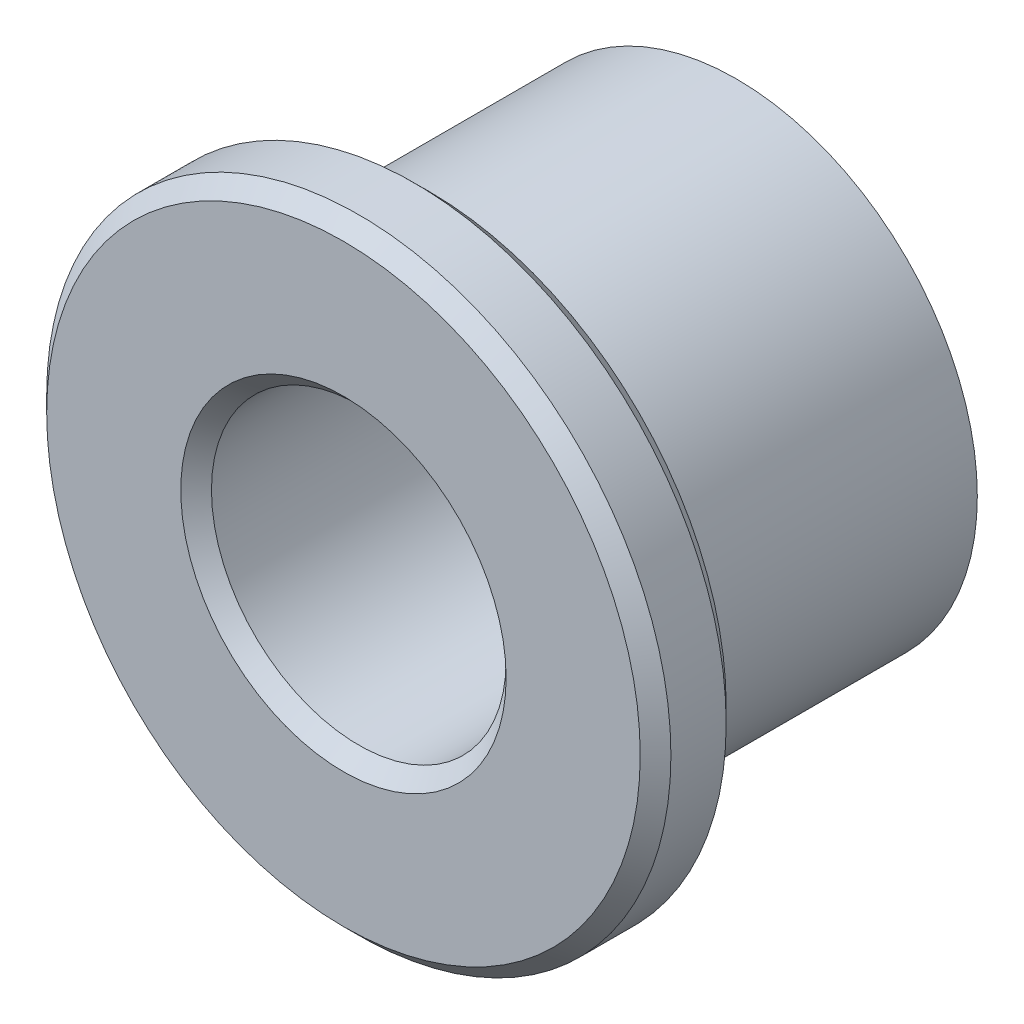
from build123d import *

# Parameters (mm, degrees)
SKETCH1_R           = 3.925
BOSS_EXTRUDE1_DEPTH = 11
SKETCH2_R           = 5.084149635
BOSS_EXTRUDE2_DEPTH = 1.4
SKETCH3_R           = 2.4
CUT_EXTRUDE1_DEPTH  = 15.333776719
CHAMFER1_SIZE       = 0.25
CUT_EXTRUDE2_START  = -6
SKETCH4_R           = 6.115916059
CUT_EXTRUDE2_DEPTH  = 6


with BuildPart() as part:
    # Sketch1 → Boss-Extrude1 (new body)
    with BuildSketch(Plane.XY):
        Circle(SKETCH1_R)
    extrude(amount=-BOSS_EXTRUDE1_DEPTH)

    # Sketch2 → Boss-Extrude2 (add)
    with BuildSketch(Plane.XY):
        Circle(SKETCH2_R)
    extrude(amount=BOSS_EXTRUDE2_DEPTH)

    # Sketch3 → Cut-Extrude1 (cut, through all)
    with BuildSketch(Plane.XY.offset(1.4)):
        Circle(SKETCH3_R)
    extrude(amount=-CUT_EXTRUDE1_DEPTH, mode=Mode.SUBTRACT)

    # Chamfer1
    chamfer1_edges = [part.edges().sort_by_distance(p)[0] for p in [
        (-2.4, 0, -11),
        (-2.4, 0, 1.4),
        (-3.925, 0, -11),
        (-5.084149635, 0, 0),
        (-5.084149635, 0, 1.4),
    ]]
    chamfer(chamfer1_edges, length=CHAMFER1_SIZE)

    # Sketch4 → Cut-Extrude2 (cut)
    with BuildSketch(Plane(origin=(0, 0, -11), x_dir=(-1, 0, 0), z_dir=(0, 0, -1)).offset(CUT_EXTRUDE2_START)):
        Circle(SKETCH4_R)
    extrude(amount=CUT_EXTRUDE2_DEPTH, mode=Mode.SUBTRACT)


solid = part.part
